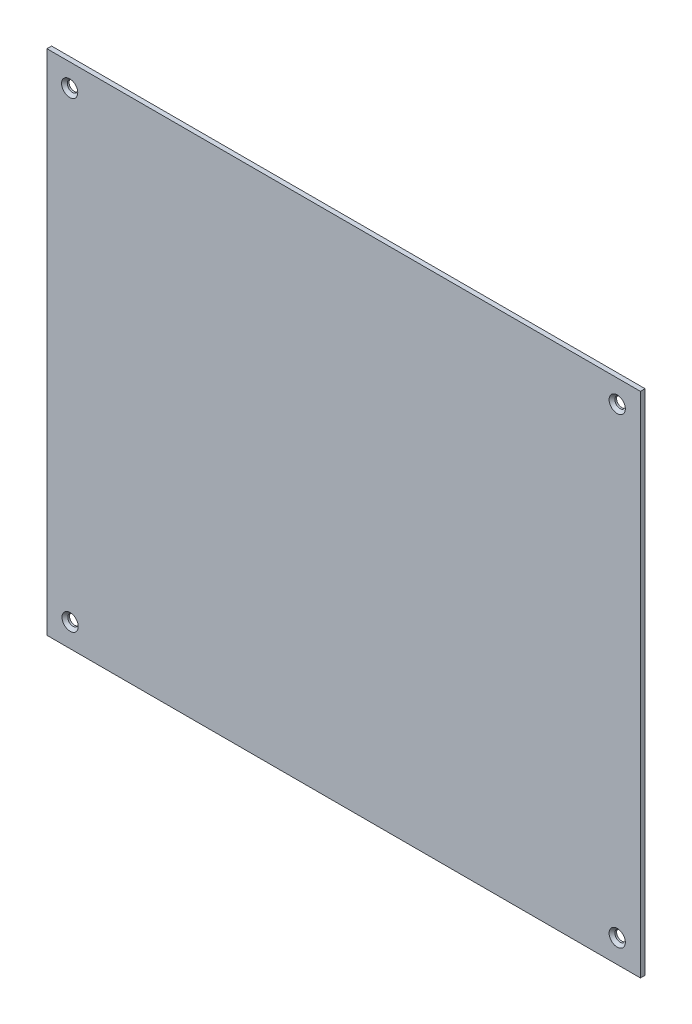
from build123d import *

# Parameters (mm, degrees)
SKETCH1_W                      = 243.332
SKETCH1_H                      = 208.28
BOSS_EXTRUDE1_DEPTH            = 1.905
F_6_CLEARANCE_HOLE1_AT_2_COUNT = 2
F_6_CLEARANCE_HOLE1_AT_2_PITCH = 224.482001
F_6_CLEARANCE_HOLE1_AT_3_COUNT = 2
F_6_CLEARANCE_HOLE1_AT_3_PITCH = 293.727584765
F_6_CLEARANCE_HOLE1_AT_4_COUNT = 2
F_6_CLEARANCE_HOLE1_AT_4_PITCH = 189.430106581


with BuildPart() as part:
    # Sketch1 → Boss-Extrude1 (new body)
    with BuildSketch(Plane.XY):
        with Locations((121.666, 104.14)):
            Rectangle(SKETCH1_W, SKETCH1_H)
    extrude(amount=BOSS_EXTRUDE1_DEPTH)

    # Sketch5 → #6 Clearance Hole1 (revolve, cut)
    with BuildSketch(Plane(origin=(9.324999, 198.955001, 1.905), x_dir=(0, -1, 0), z_dir=(1, 0, 0))):
        Polygon((0, 0), (0, 1.905), (2.15265, 1.905), (2.15265, 1.17475), (3.3274, 0), align=None)
    f_6_clearance_hole1 = revolve(axis=Axis((9.324999, 198.955001, 8.255), (0, 0, -1)), mode=Mode.SUBTRACT)

    # #6 Clearance Hole1 at 2: #6 Clearance Hole1 ×2
    with Locations(*[(i * F_6_CLEARANCE_HOLE1_AT_2_PITCH, 0, 0) for i in range(1, F_6_CLEARANCE_HOLE1_AT_2_COUNT)]):
        add(f_6_clearance_hole1, mode=Mode.SUBTRACT)

    # #6 Clearance Hole1 at 3: #6 Clearance Hole1 ×2
    with Locations(*[Vector(0.7642523639026707, -0.6449173003332906, 0) * (i * F_6_CLEARANCE_HOLE1_AT_3_PITCH) for i in range(1, F_6_CLEARANCE_HOLE1_AT_3_COUNT)]):
        add(f_6_clearance_hole1, mode=Mode.SUBTRACT)

    # #6 Clearance Hole1 at 4: #6 Clearance Hole1 ×2
    with Locations(*[Vector(0.0010558036608261825, -0.9999994426391596, 0) * (i * F_6_CLEARANCE_HOLE1_AT_4_PITCH) for i in range(1, F_6_CLEARANCE_HOLE1_AT_4_COUNT)]):
        add(f_6_clearance_hole1, mode=Mode.SUBTRACT)


solid = part.part
